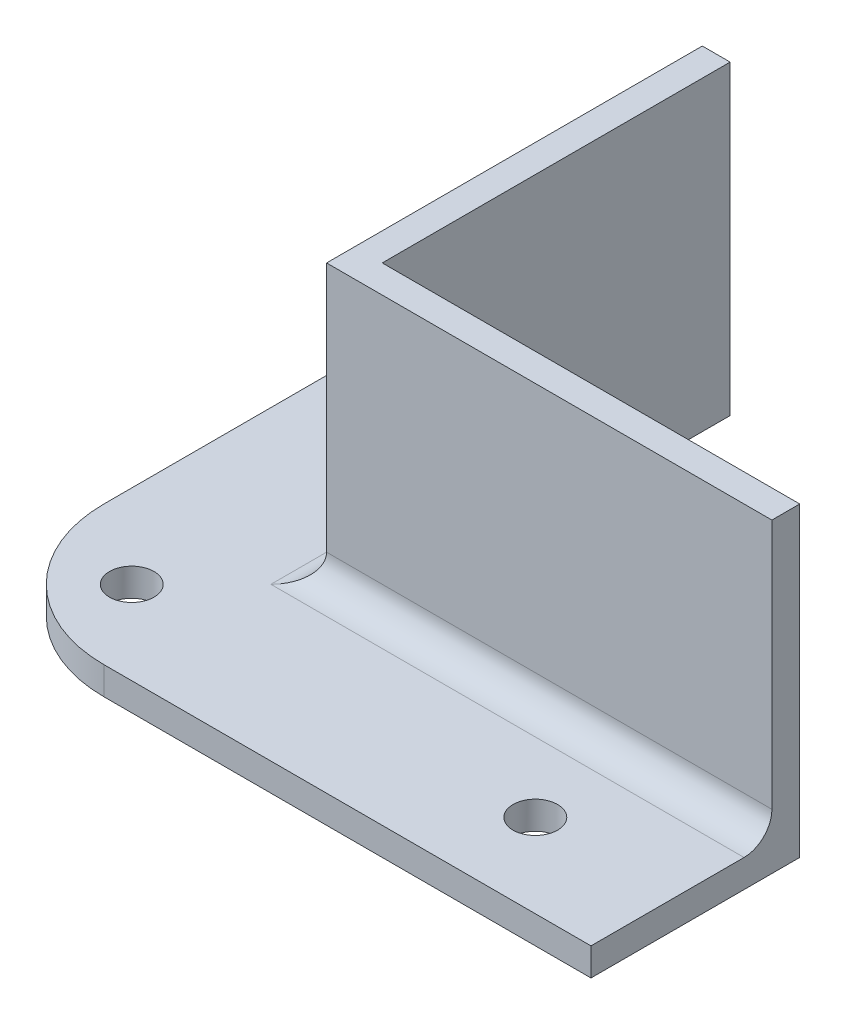
from build123d import *

# Parameters (mm, degrees)
BOSS_EXTRUDE1_DEPTH = 2
BOSS_EXTRUDE2_DEPTH = 20
FILLET1_R           = 2
FILLET2_R           = 10
SKETCH3_R           = 1.6
CUT_EXTRUDE1_DEPTH  = 20


with BuildPart() as part:
    # Sketch1 → Boss-Extrude1 (new body)
    with BuildSketch(Plane(origin=(0, 0, 0), x_dir=(1, 0, 0), z_dir=(0, 1, 0))):
        Polygon((-23.929292929, 25), (-8.929292929, 25), (-8.929292929, 0), (21.070707071, 0), (21.070707071, -15), (-23.929292929, -15), align=None)
    extrude(amount=BOSS_EXTRUDE1_DEPTH)

    # Sketch2 → Boss-Extrude2 (add)
    with BuildSketch(Plane(origin=(0, 2, 0), x_dir=(1, 0, 0), z_dir=(0, 1, 0))):
        Polygon((-8.929292929, 25), (-10.929292929, 25), (-10.929292929, -2), (21.070707071, -2), (21.070707071, 0), (-8.929292929, 0), align=None)
    extrude(amount=BOSS_EXTRUDE2_DEPTH)

    # Fillet1
    fillet1_edges = [part.edges().sort_by_distance(p)[0] for p in [
        (-10.929292929, 2, -11.5),
        (5.070707071, 2, 2),
    ]]
    fillet(fillet1_edges, radius=FILLET1_R)

    # Fillet2
    fillet2_edges = [part.edges().sort_by_distance(p)[0] for p in [
        (-23.929292929, 1, 15),
    ]]
    fillet(fillet2_edges, radius=FILLET2_R)

    # Sketch3 → Cut-Extrude1 (cut)
    with BuildSketch(Plane(origin=(0, 2, 0), x_dir=(1, 0, 0), z_dir=(0, 1, 0))):
        with Locations(Location((-17.929292929, 15, 0), (0, 0, 270))):
            Circle(SKETCH3_R)
        with Locations(Location((11.070707071, -9, 0), (0, 0, 270))):
            Circle(SKETCH3_R)
        with Locations(Location((-17.929292929, -9, 0), (0, 0, 270))):
            Circle(SKETCH3_R)
    extrude(amount=-CUT_EXTRUDE1_DEPTH, mode=Mode.SUBTRACT)


solid = part.part
